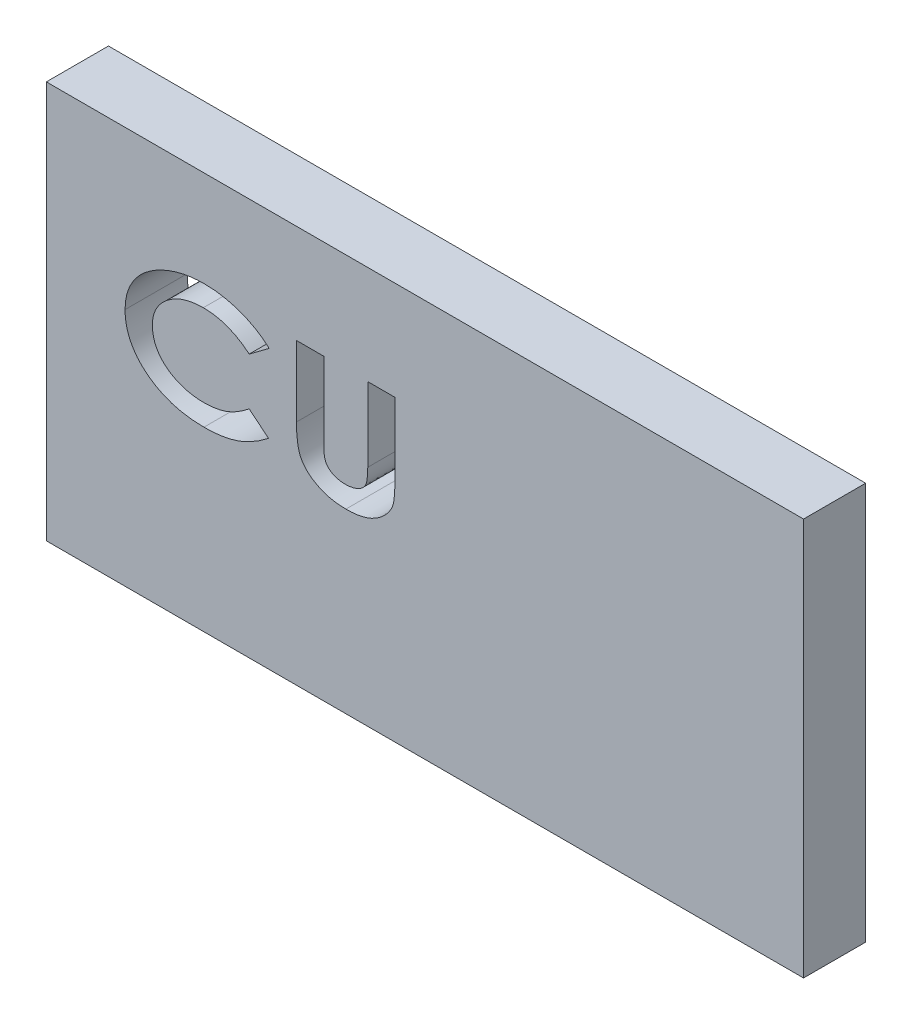
from build123d import *

# Parameters (mm, degrees)
SKETCH1_W           = 60.96
SKETCH1_H           = 32
BOSS_EXTRUDE1_DEPTH = 5
EMBOSS_ID_DEPTH     = 70.029860206


with BuildPart() as part:
    # Sketch1 → Boss-Extrude1 (new body)
    with BuildSketch(Plane.XY):
        with Locations((30.48, 16)):
            Rectangle(SKETCH1_W, SKETCH1_H)
    extrude(amount=BOSS_EXTRUDE1_DEPTH)

    # Sketch2 → Emboss ID (cut, through all)
    with BuildSketch(Plane.XY.offset(5)):
        with BuildLine():
            Line((17.939351554, 22.385543264), (16.330862973, 21.187286052))
            add(Edge.make_bspline(
                [(16.330862973, 21.187286052), (16.193948378, 21.297715975), (15.923653785, 21.515724953), (15.492973286, 21.798840943), (15.047367137, 22.035660675), (14.591556167, 22.234362101), (14.120676391, 22.384969773), (13.638201742, 22.494183694), (13.142481102, 22.561047897), (12.807530408, 22.568684892), (12.638780641, 22.572532447)],
                knots=[0, 0, 0, 0, 1.047498183, 2.067954082, 3.064716014, 4.050834122, 5.026236419, 6.005216353, 6.995018425, 8, 8, 8, 8], degree=3))
            add(Edge.make_bspline(
                [(12.638780641, 22.572532447), (12.497481029, 22.569487838), (12.21927812, 22.563493348), (11.810745229, 22.519601633), (11.419280298, 22.444369955), (11.044470447, 22.34280748), (10.687651123, 22.207349779), (10.346437238, 22.045735799), (10.023213383, 21.851764747), (9.720204018, 21.631871552), (9.442439495, 21.392367661), (9.200431341, 21.134021384), (8.996847742, 20.860666581), (8.826973709, 20.575798318), (8.695567897, 20.275283472), (8.604777134, 19.960201003), (8.54738541, 19.631764169), (8.540139659, 19.407946223), (8.536466939, 19.294497591)],
                knots=[0, 0, 0, 0, 1.161512295, 2.286885957, 3.372846391, 4.435843892, 5.47496362, 6.506332606, 7.535751468, 8.569066898, 9.580846572, 10.54639173, 11.472909722, 12.377706805, 13.267498426, 14.160969422, 15.067833891, 16, 16, 16, 16], degree=3))
            add(Edge.make_bspline(
                [(8.536466939, 19.294497591), (8.537751012, 19.214929364), (8.540284583, 19.057935472), (8.565924333, 18.825720128), (8.60786814, 18.600689319), (8.665349484, 18.382634838), (8.737372205, 18.17065425), (8.830317123, 17.966837444), (8.936740051, 17.768167118), (9.058905845, 17.577209892), (9.196609824, 17.395263336), (9.349857951, 17.224443849), (9.514380246, 17.060645792), (9.693743683, 16.908331688), (9.887519777, 16.767033211), (10.094004328, 16.635133763), (10.314044218, 16.513283481), (10.545872675, 16.400128798), (10.789738097, 16.3029734), (11.039684707, 16.213451519), (11.297617359, 16.141828196), (11.561470398, 16.083281023), (11.831057644, 16.033923593), (12.108463129, 16.003492867), (12.392253662, 15.980416587), (12.584033251, 15.979010727), (12.680757804, 15.978301677)],
                knots=[0, 0, 0, 0, 0.965450175, 1.904903346, 2.831518626, 3.741520969, 4.639923735, 5.545231674, 6.457065799, 7.37359341, 8.293787342, 9.223356292, 10.15679573, 11.109664492, 12.076225089, 13.065575861, 14.081553357, 15.127701224, 16.194242876, 17.266051707, 18.348703372, 19.440563194, 20.546010598, 21.673026615, 22.826384687, 24, 24, 24, 24], degree=3))
            add(Edge.make_bspline(
                [(12.680757804, 15.978301677), (12.84372405, 15.982055774), (13.164254901, 15.989439536), (13.633748965, 16.044848187), (14.08166717, 16.139235536), (14.441100802, 16.247587348), (14.723240332, 16.357231151), (14.937590367, 16.457285766), (15.158130454, 16.570023703), (15.383121743, 16.698558163), (15.61450476, 16.840932517), (15.848128474, 17.002764083), (16.08958315, 17.17578223), (16.249234139, 17.300023876), (16.330862973, 17.363548072)],
                knots=[0, 0, 0, 0, 1.46963059, 2.890549154, 4.256359375, 5.593721101, 6.271220114, 6.984770085, 7.726205572, 8.504599441, 9.321221579, 10.175632609, 11.067209143, 12, 12, 12, 12], degree=3))
            Line((16.330862973, 17.363548072), (17.889742179, 16.087060692))
            add(Edge.make_bspline(
                [(17.889742179, 16.087060692), (17.780177509, 16.00438673), (17.565256789, 15.842214495), (17.241012283, 15.61419324), (16.919423563, 15.409030539), (16.605339312, 15.218642645), (16.294120851, 15.050140621), (15.986117215, 14.904285447), (15.685046943, 14.772396022), (15.384225887, 14.663817549), (15.08144872, 14.568550548), (14.769675315, 14.489294946), (14.448375358, 14.420345604), (14.115915427, 14.365350871), (13.774207016, 14.321218291), (13.421487444, 14.291580306), (13.058791545, 14.271296938), (12.813078483, 14.269565116), (12.688390016, 14.268686293)],
                knots=[0, 0, 0, 0, 1.170168288, 2.295387817, 3.378357592, 4.421752238, 5.426193512, 6.393913974, 7.32663767, 8.227237166, 9.119060518, 10.031788755, 10.968742797, 11.91991457, 12.903890504, 13.90538553, 14.937076171, 16, 16, 16, 16], degree=3))
            add(Edge.make_bspline(
                [(12.688390016, 14.268686293), (12.460549115, 14.273250497), (12.014732908, 14.282181273), (11.362028482, 14.347094198), (10.74136888, 14.457712039), (10.151958232, 14.611570783), (9.593876738, 14.810632024), (9.067183823, 15.053083428), (8.572466584, 15.340277099), (8.188664002, 15.616284027), (7.901376842, 15.854516837), (7.699879682, 16.040918354), (7.512056073, 16.232591564), (7.336607405, 16.429422552), (7.17833247, 16.635232358), (7.031731009, 16.84553331), (6.898940423, 17.062680003), (6.781091136, 17.286001712), (6.675383802, 17.514854103), (6.586073948, 17.750456425), (6.509327085, 17.991787982), (6.446101894, 18.239482977), (6.398934718, 18.493940975), (6.364671937, 18.75378418), (6.343040218, 19.020010594), (6.339953274, 19.19969006), (6.338390016, 19.290681485)],
                knots=[0, 0, 0, 0, 1.811886863, 3.545318357, 5.210258498, 6.821188673, 8.384332979, 9.916537402, 11.426114527, 12.926732761, 13.670233396, 14.393304328, 15.108691124, 15.80390781, 16.48889144, 17.172229551, 17.841952478, 18.511732709, 19.179446893, 19.845492101, 20.514182713, 21.192616893, 21.877152137, 22.571079508, 23.276380798, 24, 24, 24, 24], degree=3))
            add(Edge.make_bspline(
                [(6.338390016, 19.290681485), (6.34107973, 19.407807097), (6.346414966, 19.640133887), (6.385156843, 19.982767766), (6.448730494, 20.315585335), (6.535357718, 20.63849786), (6.651846368, 20.951005755), (6.789761835, 21.254311961), (6.956368351, 21.546080554), (7.144689275, 21.828723114), (7.35823036, 22.098878571), (7.594922449, 22.355732414), (7.851958874, 22.600658658), (8.133737575, 22.82844434), (8.434271431, 23.04563216), (8.757707334, 23.247780638), (9.103405783, 23.436162736), (9.46821901, 23.610965787), (9.847740787, 23.768524359), (10.237023856, 23.905776195), (10.63312239, 24.022457568), (11.036070987, 24.118732943), (11.447366383, 24.189801098), (11.865431019, 24.244564158), (12.291075961, 24.274525371), (12.577045263, 24.279597587), (12.720826915, 24.282147831)],
                knots=[0, 0, 0, 0, 0.935710299, 1.856046398, 2.751032788, 3.641086013, 4.523738995, 5.41281973, 6.300301529, 7.20514491, 8.124189388, 9.04851525, 9.993890135, 10.958196572, 11.941188203, 12.954947156, 14.003331554, 15.085245736, 16.185631645, 17.284972737, 18.38160913, 19.483542832, 20.593043469, 21.714996232, 22.851129778, 24, 24, 24, 24], degree=3))
            add(Edge.make_bspline(
                [(12.720826915, 24.282147831), (12.843615344, 24.280691668), (13.088768061, 24.277784373), (13.454148638, 24.254018231), (13.81659209, 24.216737438), (14.174568684, 24.159910454), (14.530414074, 24.09294103), (14.881639678, 24.004923758), (15.230888101, 23.907898727), (15.573739394, 23.789803397), (15.910120639, 23.6622282), (16.234720456, 23.51786734), (16.549464129, 23.363605366), (16.851182833, 23.194504061), (17.141222395, 23.011831269), (17.419683975, 22.817301053), (17.687714604, 22.610345684), (17.855622715, 22.460343271), (17.939351554, 22.385543264)],
                knots=[0, 0, 0, 0, 1.037918018, 2.072250816, 3.094113102, 4.116880266, 5.1354982, 6.153960031, 7.176840249, 8.198702535, 9.218185693, 10.217217538, 11.200675921, 12.180379311, 13.139566827, 14.097155671, 15.051130131, 16, 16, 16, 16], degree=3))
        make_face()
        with BuildLine():
            Line((20.137428477, 24.037917062), (22.3355054, 24.037917062))
            Line((22.3355054, 24.037917062), (22.3355054, 17.840561293))
            add(Edge.make_bspline(
                [(22.3355054, 17.840561293), (22.335467378, 17.776304305), (22.33539392, 17.652162176), (22.346134636, 17.474071054), (22.358528377, 17.310378972), (22.377648866, 17.161385077), (22.401541348, 17.026081234), (22.432682267, 16.905990173), (22.465177043, 16.799398735), (22.522876491, 16.679914763), (22.60746056, 16.543484547), (22.743941606, 16.404206873), (22.902486412, 16.276396333), (23.091587874, 16.169972781), (23.304940968, 16.085635489), (23.540141783, 16.021393399), (23.796672751, 15.986550521), (23.974425427, 15.981108595), (24.066109367, 15.978301677)],
                knots=[0, 0, 0, 0, 1.042330976, 2.013744964, 2.893880655, 3.705397848, 4.450270186, 5.121044372, 5.718245416, 6.253772157, 7.270030384, 8.30662409, 9.400940003, 10.565730178, 11.811328046, 13.115564187, 14.512222457, 16, 16, 16, 16], degree=3))
            add(Edge.make_bspline(
                [(24.066109367, 15.978301677), (24.163604629, 15.980439996), (24.35194054, 15.984570682), (24.623742081, 16.02839506), (24.875739412, 16.095330981), (25.103812641, 16.193236785), (25.305842261, 16.309698228), (25.475794155, 16.443915203), (25.613771381, 16.592475863), (25.699042555, 16.734643758), (25.752867366, 16.862217157), (25.786257442, 16.977565622), (25.81482327, 17.112114692), (25.836228558, 17.265909694), (25.856056336, 17.438868675), (25.868597876, 17.631152994), (25.876327777, 17.84303895), (25.876672051, 17.99065357), (25.876851554, 18.067619586)],
                knots=[0, 0, 0, 0, 1.444790072, 2.790964898, 4.072527466, 5.302503052, 6.460906732, 7.521628549, 8.503271233, 9.451296571, 9.962868575, 10.553781864, 11.229096548, 12.001525687, 12.855738701, 13.810777885, 14.858543254, 16, 16, 16, 16], degree=3))
            Line((25.876851554, 18.067619586), (25.876851554, 24.037917062))
            Line((25.876851554, 24.037917062), (28.074928477, 24.037917062))
            Line((28.074928477, 24.037917062), (28.074928477, 18.355735572))
            add(Edge.make_bspline(
                [(28.074928477, 18.355735572), (28.074103391, 18.240609968), (28.072516743, 18.019222393), (28.063109683, 17.701129099), (28.047916434, 17.410392486), (28.02816678, 17.147409393), (27.999403862, 16.911939938), (27.965364219, 16.703735948), (27.927209976, 16.5220355), (27.862226509, 16.315790791), (27.756588424, 16.076713047), (27.585111799, 15.80471954), (27.371849968, 15.535635182), (27.114276758, 15.279018255), (26.826148688, 15.039389003), (26.513105552, 14.826387067), (26.176180275, 14.651754053), (25.81708793, 14.508831396), (25.432792344, 14.399917414), (25.01925583, 14.32556438), (24.57675483, 14.276119003), (24.27104932, 14.271210807), (24.113810689, 14.268686293)],
                knots=[0, 0, 0, 0, 1.048465452, 2.016208535, 2.897852646, 3.699721694, 4.417449558, 5.057358133, 5.620907919, 6.10638888, 7.024441343, 7.992080414, 9.026953953, 10.145102751, 11.296847888, 12.435865683, 13.58618256, 14.745679343, 15.950263297, 17.216971339, 18.568558298, 20, 20, 20, 20], degree=3))
            add(Edge.make_bspline(
                [(24.113810689, 14.268686293), (24.009455191, 14.270059097), (23.803668197, 14.272766241), (23.500014253, 14.296990014), (23.206219402, 14.332082756), (22.923259726, 14.383551175), (22.650674956, 14.450912033), (22.38779869, 14.532160916), (22.135726852, 14.629918849), (21.895615371, 14.740390867), (21.66869263, 14.862068058), (21.457926373, 14.993849703), (21.261962381, 15.130068544), (21.085711525, 15.277423955), (20.922904, 15.428258199), (20.779100298, 15.589675692), (20.652914225, 15.75869064), (20.538791028, 15.936973858), (20.441494841, 16.13635235), (20.360919254, 16.363352128), (20.290111947, 16.620198743), (20.234249503, 16.907999794), (20.191136781, 17.226602465), (20.158977065, 17.575425228), (20.140004487, 17.955467698), (20.138308665, 18.218969429), (20.137428477, 18.355735572)],
                knots=[0, 0, 0, 0, 1.139223061, 2.246525513, 3.324074361, 4.368811041, 5.384430518, 6.388205074, 7.370907534, 8.334155974, 9.272474927, 10.180097188, 11.047120909, 11.875808385, 12.686403601, 13.468414007, 14.232299858, 14.987551083, 15.776407491, 16.648561, 17.613934854, 18.683036789, 19.846822431, 21.123122364, 22.506805041, 24, 24, 24, 24], degree=3))
            Line((20.137428477, 18.355735572), (20.137428477, 24.037917062))
        make_face()
    extrude(amount=-EMBOSS_ID_DEPTH, mode=Mode.SUBTRACT)


solid = part.part
